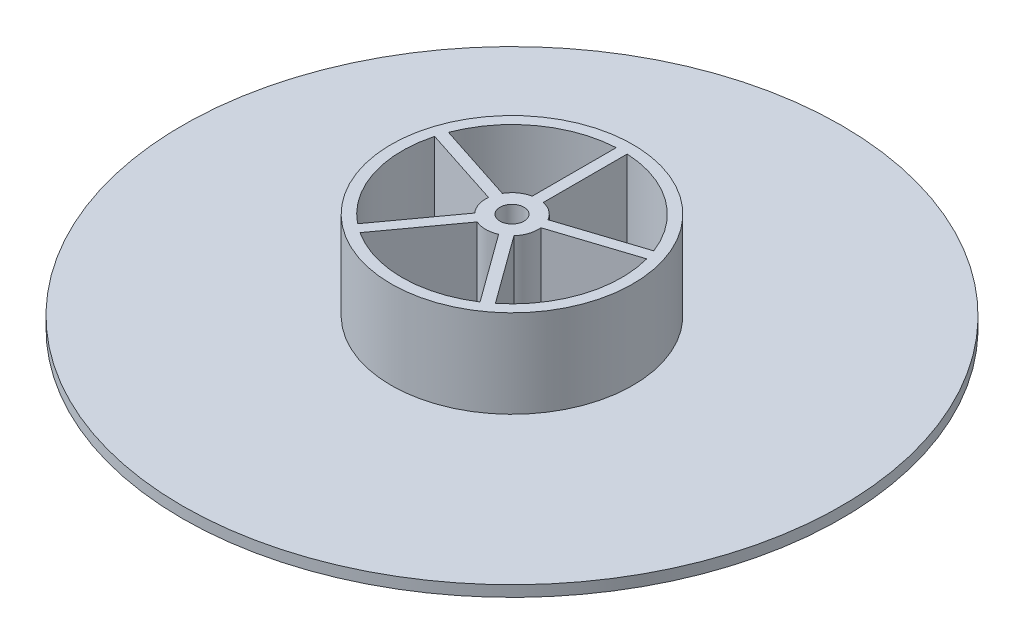
from build123d import *

# Parameters (mm, degrees)
SKETCH1_R           = 36.124355653
BOSS_EXTRUDE1_DEPTH = 1.5
SKETCH3_R           = 75
SKETCH3_R_2         = 43.124355653
BOSS_EXTRUDE2_DEPTH = 1.5
SKETCH4_R           = 75
BOSS_EXTRUDE3_DEPTH = 1
SKETCH5_R           = 27.5
SKETCH5_R_2         = 2.75
BOSS_EXTRUDE4_DEPTH = 20
CUT_EXTRUDE1_DEPTH  = 4


with BuildPart() as part:
    # Sketch1 → Boss-Extrude1 (new body)
    with BuildSketch(Plane(origin=(0, 0, 0), x_dir=(1, 0, 0), z_dir=(0, 1, 0))):
        with Locations(Location((0, 0, 0), (0, 0, 270))):
            Circle(SKETCH1_R)
    extrude(amount=BOSS_EXTRUDE1_DEPTH)



with BuildPart() as body_2:
    # Sketch3 → Boss-Extrude2 (new body)
    with BuildSketch(Plane(origin=(0, 0, 0), x_dir=(1, 0, 0), z_dir=(0, 1, 0))):
        with Locations(Location((0, 0, 0), (0, 0, 270))):
            Circle(SKETCH3_R)
        with Locations(Location((0, 0, 0), (0, 0, 270))):
            Circle(SKETCH3_R_2, mode=Mode.SUBTRACT)
    extrude(amount=BOSS_EXTRUDE2_DEPTH)


with BuildPart() as part_1:
    add(part.part)

    add(body_2.part)  # Boss-Extrude3 merges body 2
    # Sketch4 → Boss-Extrude3 (add)
    with BuildSketch(Plane(origin=(0, 1.5, 0), x_dir=(1, 0, 0), z_dir=(0, 1, 0))):
        with Locations(Location((0, 0, 0), (0, 0, 270))):
            Circle(SKETCH4_R)
    extrude(amount=BOSS_EXTRUDE3_DEPTH)

    # Sketch5 → Boss-Extrude4 (add)
    with BuildSketch(Plane(origin=(0, 2.5, 0), x_dir=(1, 0, 0), z_dir=(0, 1, 0))):
        with Locations(Location((0, 0, 0), (0, 0, 270))):
            Circle(SKETCH5_R)
        with Locations(Location((0, 0, 0), (0, 0, 270))):
            Circle(SKETCH5_R_2, mode=Mode.SUBTRACT)
        with BuildLine():
            Line((-1.25, 5.868347297), (-1.25, 24.968730444))
            ThreePointArc((-1.25, 24.968730444), (-14.694631307, 20.225424859), (-23.36040255, 8.904582681))
            Line((-23.36040255, 8.904582681), (-5.194858694, 3.002239689))
            ThreePointArc((-5.194858694, 3.002239689), (-3.526711514, 4.854101966), (-1.25, 5.868347297))
        make_face(mode=Mode.SUBTRACT)
        with BuildLine():
            Line((1.25, 5.868347297), (1.25, 24.968730444))
            ThreePointArc((1.25, 24.968730444), (14.694631307, 20.225424859), (23.36040255, 8.904582681))
            Line((23.36040255, 8.904582681), (5.194858694, 3.002239689))
            ThreePointArc((5.194858694, 3.002239689), (3.526711514, 4.854101966), (1.25, 5.868347297))
        make_face(mode=Mode.SUBTRACT)
        with BuildLine():
            Line((5.96740118, 0.624598398), (24.132945036, 6.52694139))
            ThreePointArc((24.132945036, 6.52694139), (23.776412907, -7.725424859), (15.687522767, -19.465395692))
            Line((15.687522767, -19.465395692), (4.46059924, -4.012861127))
            ThreePointArc((4.46059924, -4.012861127), (5.706339098, -1.854101966), (5.96740118, 0.624598398))
        make_face(mode=Mode.SUBTRACT)
        with BuildLine():
            Line((2.438056754, -5.482324258), (13.664980281, -20.934858823))
            ThreePointArc((13.664980281, -20.934858823), (0, -25), (-13.664980281, -20.934858823))
            Line((-13.664980281, -20.934858823), (-2.438056754, -5.482324258))
            ThreePointArc((-2.438056754, -5.482324258), (0, -6), (2.438056754, -5.482324258))
        make_face(mode=Mode.SUBTRACT)
        with BuildLine():
            Line((-4.46059924, -4.012861127), (-15.687522767, -19.465395692))
            ThreePointArc((-15.687522767, -19.465395692), (-23.776412907, -7.725424859), (-24.132945036, 6.52694139))
            Line((-24.132945036, 6.52694139), (-5.96740118, 0.624598398))
            ThreePointArc((-5.96740118, 0.624598398), (-5.706339098, -1.854101966), (-4.46059924, -4.012861127))
        make_face(mode=Mode.SUBTRACT)
    extrude(amount=BOSS_EXTRUDE4_DEPTH)

    # Sketch6 → Cut-Extrude1 (cut)
    with BuildSketch(Plane.XZ):
        Polygon((-4, 2.309401077), (-4, -2.309401077), (0, -4.618802154), (4, -2.309401077), (4, 2.309401077), (0, 4.618802154), align=None)
    extrude(amount=-CUT_EXTRUDE1_DEPTH, mode=Mode.SUBTRACT)


solid = part_1.part
